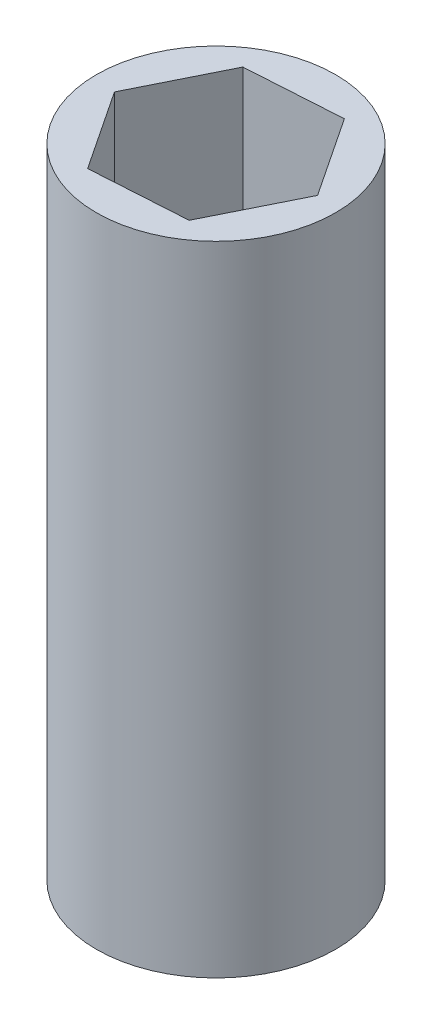
from build123d import *

# Parameters (mm, degrees)
SKETCH1_R           = 9.525
BOSS_EXTRUDE1_DEPTH = 50.8


with BuildPart() as part:
    # Sketch1 → Boss-Extrude1 (new body)
    with BuildSketch(Plane(origin=(0, 0, 0), x_dir=(1, 0, 0), z_dir=(0, 1, 0))):
        with Locations(Location((0, 0, 0), (0, 0, 270))):
            Circle(SKETCH1_R)
        Polygon((3.393313815, 6.829044053), (-4.217468726, 6.353217994), (-7.610782542, -0.47582606), (-3.393313815, -6.829044053), (4.217468726, -6.353217994), (7.610782542, 0.47582606), align=None, mode=Mode.SUBTRACT)
    extrude(amount=BOSS_EXTRUDE1_DEPTH)


solid = part.part
